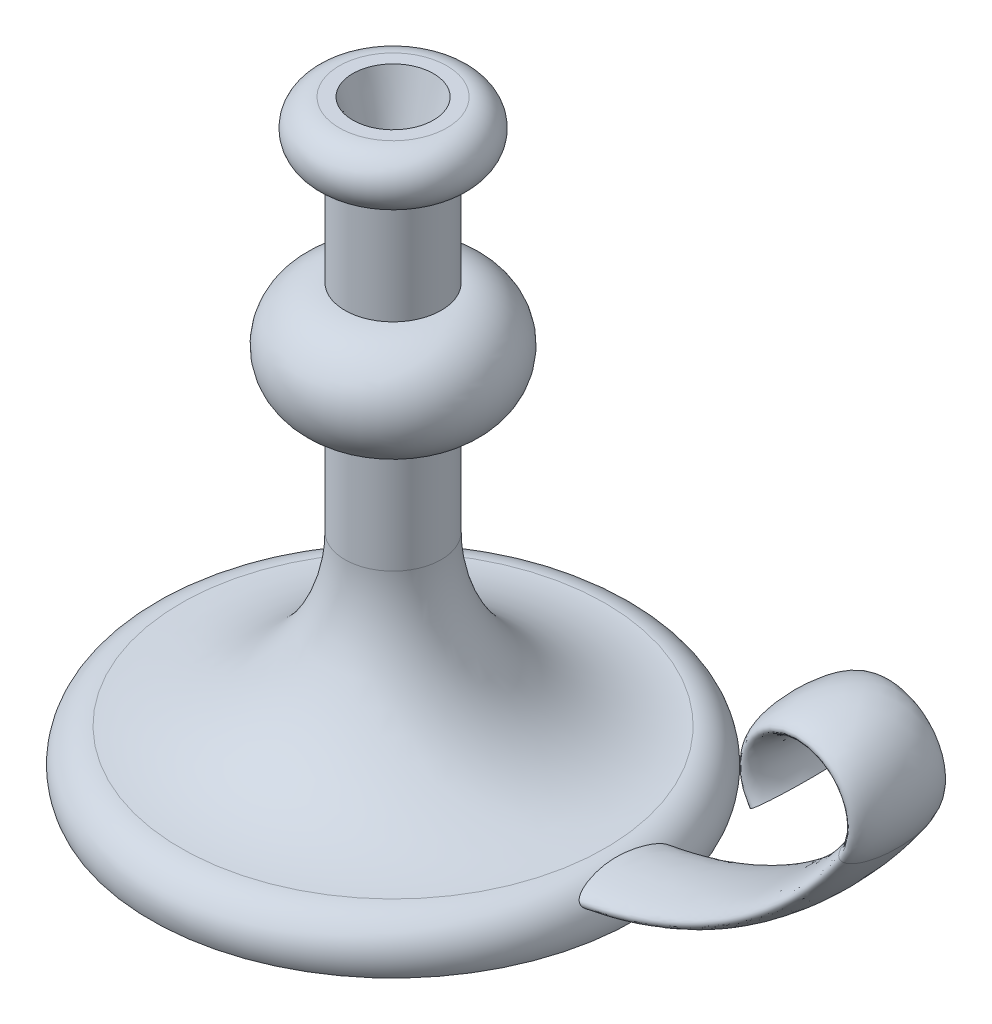
from build123d import *

# Parameters (mm, degrees)
SKETCH4_RX         = 17.5
SKETCH4_RY         = 5
SKETCH7_R          = 15
CUT_EXTRUDE3_DEPTH = 25
CUT_EXTRUDE3_DRAFT = -15


with BuildPart() as part:
    # Sketch1 → Revolve1 (revolve)
    with BuildSketch(Plane.XY, mode=Mode.PRIVATE) as revolve1_sk:
        with BuildLine():
            Line((0, 0), (0, 220))
            Line((0, 220), (20, 220))
            ThreePointArc((20, 220), (29.944443098, 208.947359758), (17.906415801, 200.221610296))
            Line((17.906415801, 200.221610296), (17.906415801, 160.221610296))
            ThreePointArc((17.906415801, 160.221610296), (37.579236249, 140.224286637), (17.906415801, 120.226962977))
            Line((17.906415801, 120.226962977), (17.906415801, 80))
            ThreePointArc((17.906415801, 80), (35.679501471, 36.377285025), (78.877706124, 17.595939205))
            ThreePointArc((78.877706124, 17.595939205), (89.153569567, 11.7781153), (90, 0))
            Line((90, 0), (0, 0))
        make_face()
    revolve(revolve1_sk.sketch.rotate(Axis((0, 0, 0), (0, 1, 0)), 90), axis=Axis((0, 0, 0), (0, 1, 0)))

    # Sweep1: sweep along a path in Sketch3
    with BuildLine(Plane.XY) as sweep1_path:
        Line((0, 10), (60, 10))
        ThreePointArc((60, 10), (129.821200219, 27.240819526), (183.592070943, 75))
        ThreePointArc((183.592070943, 75), (167.113128151, 106.333333333), (150.634185358, 75))
    # Sketch4 → Sweep1 (sweep)
    with BuildSketch(Plane(origin=(0, 0, 0), x_dir=(0, 0, -1), z_dir=(1, 0, 0))):
        with Locations((0, 10)):
            Ellipse(SKETCH4_RX, SKETCH4_RY)
    sweep(path=sweep1_path.line)


with BuildPart() as cut_extrude3_tool:
    # Sketch7 → Cut-Extrude3 (with draft: the straight prism first)
    with BuildSketch(Plane(origin=(0, 220, 0), x_dir=(1, 0, 0), z_dir=(0, 1, 0))):
        Circle(SKETCH7_R)
    extrude(amount=-CUT_EXTRUDE3_DEPTH)
    # Cut-Extrude3: the draft: its side faces are tilted about the plane it starts from
    cut_extrude3_sides = [cut_extrude3_tool.faces().sort_by_distance(p)[0] for p in [
        (-15, 207.5, 0),
    ]]
    draft(cut_extrude3_sides, Plane(origin=(0, 220, 0), x_dir=(1, 0, 0), z_dir=(0, 1, 0)), CUT_EXTRUDE3_DRAFT)


with BuildPart() as part_1:
    add(part.part)

    # Cut-Extrude3: cut by cut_extrude3_tool
    add(cut_extrude3_tool.part, mode=Mode.SUBTRACT)


solid = part_1.part
